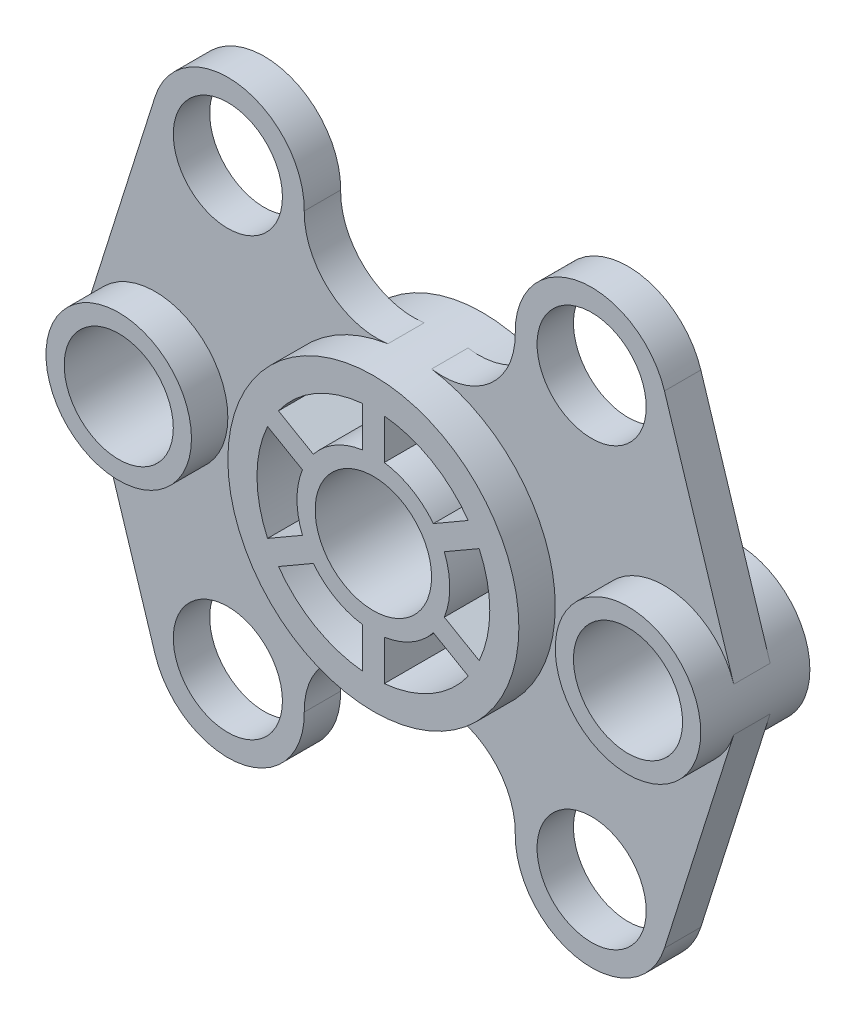
from build123d import *

# Parameters (mm, degrees)
SKETCH1_R             = 20
SKETCH1_R_2           = 15
BOSS_EXTRUDE1_DEPTH   = 15
SKETCH1_R_3           = 40
SKETCH1_R_4           = 16
BOSS_EXTRUDE1_2_DEPTH = 15
BOSS_EXTRUDE1_3_DEPTH = 15
SKETCH1_3_R           = 15
BOSS_EXTRUDE2_DEPTH   = 5


with BuildPart() as part:
    # Sketch1 → Boss-Extrude1 (new, symmetric)
    with BuildSketch(Plane.XY):
        with Locations((-70, 0)):
            Circle(SKETCH1_R)
        with Locations((-70, 0)):
            Circle(SKETCH1_R_2, mode=Mode.SUBTRACT)
    extrude(amount=BOSS_EXTRUDE1_DEPTH, both=True)



with BuildPart() as body_2:
    # Sketch1 → Boss-Extrude1 2 (new, symmetric)
    with BuildSketch(Plane.XY):
        Circle(SKETCH1_R_3)
        with BuildLine():
            Line((-3, -20.784609691), (-3, -31.859064644))
            ThreePointArc((-3, -31.859064644), (-16, -27.712812921), (-26.090759323, -18.527608533))
            Line((-26.090759323, -18.527608533), (-16.5, -12.990381057))
            ThreePointArc((-16.5, -12.990381057), (-10.5, -18.186533479), (-3, -20.784609691))
        make_face(mode=Mode.SUBTRACT)
        with BuildLine():
            Line((-19.5, -7.794228634), (-29.090759323, -13.331456111))
            ThreePointArc((-29.090759323, -13.331456111), (-32, 0), (-29.090759323, 13.331456111))
            Line((-29.090759323, 13.331456111), (-19.5, 7.794228634))
            ThreePointArc((-19.5, 7.794228634), (-21, 0), (-19.5, -7.794228634))
        make_face(mode=Mode.SUBTRACT)
        with BuildLine():
            Line((16.5, -12.990381057), (26.090759323, -18.527608533))
            ThreePointArc((26.090759323, -18.527608533), (16, -27.712812921), (3, -31.859064644))
            Line((3, -31.859064644), (3, -20.784609691))
            ThreePointArc((3, -20.784609691), (10.5, -18.186533479), (16.5, -12.990381057))
        make_face(mode=Mode.SUBTRACT)
        with BuildLine():
            ThreePointArc((-26.090759323, 18.527608533), (-16, 27.712812921), (-3, 31.859064644))
            Line((-3, 31.859064644), (-3, 20.784609691))
            ThreePointArc((-3, 20.784609691), (-10.5, 18.186533479), (-16.5, 12.990381057))
            Line((-16.5, 12.990381057), (-26.090759323, 18.527608533))
        make_face(mode=Mode.SUBTRACT)
        Circle(SKETCH1_R_4, mode=Mode.SUBTRACT)
        with BuildLine():
            Line((19.5, 7.794228634), (29.090759323, 13.331456111))
            ThreePointArc((29.090759323, 13.331456111), (32, 0), (29.090759323, -13.331456111))
            Line((29.090759323, -13.331456111), (19.5, -7.794228634))
            ThreePointArc((19.5, -7.794228634), (21, 0), (19.5, 7.794228634))
        make_face(mode=Mode.SUBTRACT)
        with BuildLine():
            Line((3, 20.784609691), (3, 31.859064644))
            ThreePointArc((3, 31.859064644), (16, 27.712812921), (26.090759323, 18.527608533))
            Line((26.090759323, 18.527608533), (16.5, 12.990381057))
            ThreePointArc((16.5, 12.990381057), (10.5, 18.186533479), (3, 20.784609691))
        make_face(mode=Mode.SUBTRACT)
    extrude(amount=BOSS_EXTRUDE1_2_DEPTH, both=True)


with BuildPart() as body_3:
    # Sketch1 → Boss-Extrude1 3 (new, symmetric)
    with BuildSketch(Plane.XY):
        with Locations((70, 0)):
            Circle(SKETCH1_R)
        with Locations((70, 0)):
            Circle(SKETCH1_R_2, mode=Mode.SUBTRACT)
    extrude(amount=BOSS_EXTRUDE1_3_DEPTH, both=True)


with BuildPart() as part_1:
    add(part.part)

    add(body_2.part)  # Boss-Extrude2 merges body 2

    add(body_3.part)  # Boss-Extrude2 merges body 3
    # Sketch1<3> → Boss-Extrude2 (add, symmetric)
    # profile 1 of 2: a face of its own
    with BuildSketch(Plane.XY):
        with BuildLine():
            ThreePointArc((-89.071294105, 6.023764702), (-50, 0), (-89.071294105, -6.023764702))
            Line((-89.071294105, -6.023764702), (-70.02485881, -66.324952937))
            ThreePointArc((-70.02485881, -66.324952937), (-46.6282273, -80.727545655), (-29.002885891, -59.651863383))
            ThreePointArc((-29.002885891, -59.651863383), (-22.168588856, -44.262528341), (-6.003756239, -39.546869801))
            ThreePointArc((-6.003756239, -39.546869801), (-40, 0), (-6.003756239, 39.546869801))
            ThreePointArc((-6.003756239, 39.546869801), (-22.168588856, 44.262528341), (-29.002885891, 59.651863383))
            ThreePointArc((-29.002885891, 59.651863383), (-46.6282273, 80.727545655), (-70.02485881, 66.324952937))
            Line((-70.02485881, 66.324952937), (-89.071294105, 6.023764702))
        make_face()
        with Locations((-50, -60)):
            Circle(SKETCH1_3_R, mode=Mode.SUBTRACT)
        with Locations((-50, 60)):
            Circle(SKETCH1_3_R, mode=Mode.SUBTRACT)
    # profile 2 of 2: a face of its own
    with BuildSketch(Plane.XY):
        with BuildLine():
            ThreePointArc((6.003756239, 39.546869801), (40, 0), (6.003756239, -39.546869801))
            ThreePointArc((6.003756239, -39.546869801), (22.168588856, -44.262528341), (29.002885891, -59.651863383))
            ThreePointArc((29.002885891, -59.651863383), (46.6282273, -80.727545655), (70.02485881, -66.324952937))
            Line((70.02485881, -66.324952937), (89.071294105, -6.023764702))
            ThreePointArc((89.071294105, -6.023764702), (50, 0), (89.071294105, 6.023764702))
            Line((89.071294105, 6.023764702), (70.02485881, 66.324952937))
            ThreePointArc((70.02485881, 66.324952937), (46.6282273, 80.727545655), (29.002885891, 59.651863383))
            ThreePointArc((29.002885891, 59.651863383), (22.168588856, 44.262528341), (6.003756239, 39.546869801))
        make_face()
        with Locations((50, -60)):
            Circle(SKETCH1_3_R, mode=Mode.SUBTRACT)
        with Locations((50, 60)):
            Circle(SKETCH1_3_R, mode=Mode.SUBTRACT)
    extrude(amount=BOSS_EXTRUDE2_DEPTH, both=True)


solid = part_1.part
